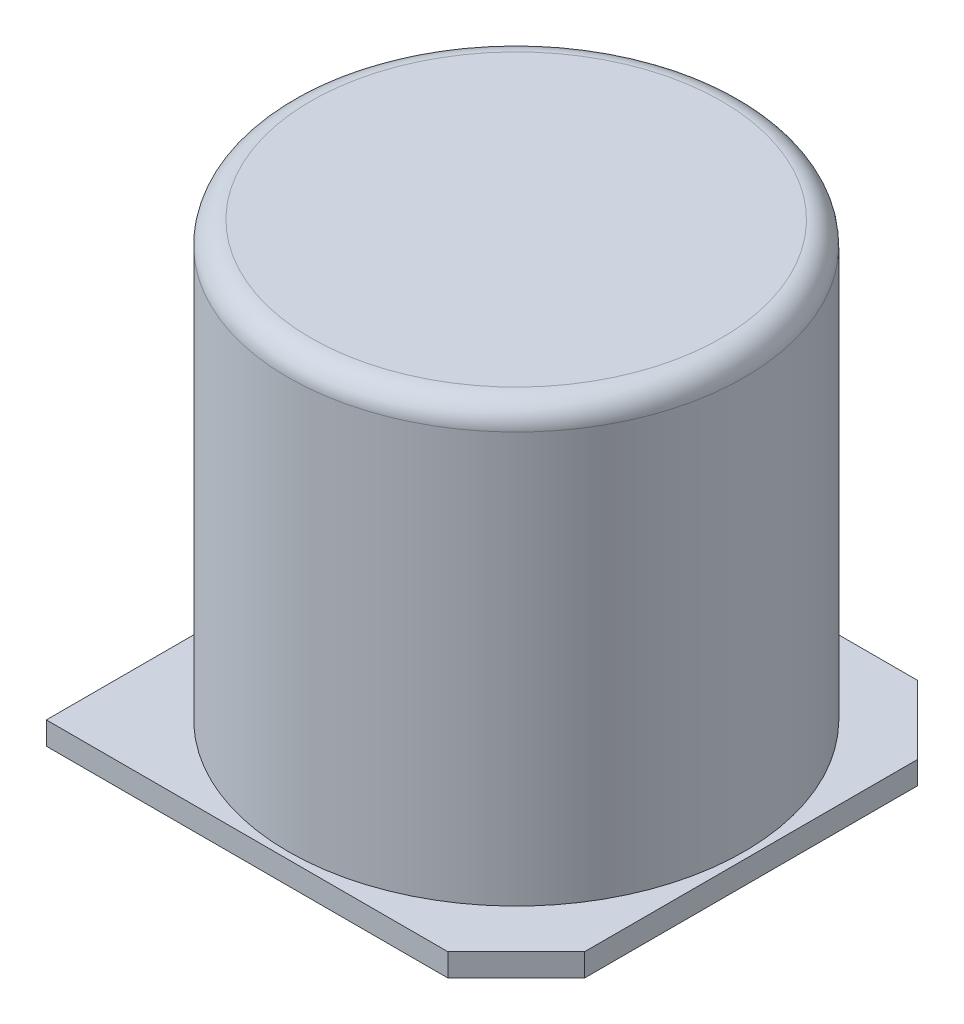
from build123d import *

# Parameters (mm, degrees)
SKETCH1_W           = 10.3
SKETCH1_H           = 10.3
BOSS_EXTRUDE1_DEPTH = 0.5
SKETCH2_R           = 5
BOSS_EXTRUDE2_DEPTH = 9.5
CHAMFER1_SIZE       = 1.5
FILLET1_R           = 0.5


with BuildPart() as part:
    # Sketch1 → Boss-Extrude1 (new body)
    with BuildSketch(Plane(origin=(0, 0, 0), x_dir=(1, 0, 0), z_dir=(0, 1, 0))):
        Rectangle(SKETCH1_W, SKETCH1_H)
    extrude(amount=BOSS_EXTRUDE1_DEPTH)

    # Sketch2 → Boss-Extrude2 (add)
    with BuildSketch(Plane(origin=(0, 0.5, 0), x_dir=(1, 0, 0), z_dir=(0, 1, 0))):
        with Locations(Location((0, 0, 0), (0, 0, 270))):
            Circle(SKETCH2_R)
    extrude(amount=BOSS_EXTRUDE2_DEPTH)

    # Chamfer1
    chamfer1_edges = [part.edges().sort_by_distance(p)[0] for p in [
        (5.15, 0.25, 5.15),
        (5.15, 0.25, -5.15),
    ]]
    chamfer(chamfer1_edges, length=CHAMFER1_SIZE)

    # Fillet1
    fillet1_edges = [part.edges().sort_by_distance(p)[0] for p in [
        (0, 10, -5),
    ]]
    fillet(fillet1_edges, radius=FILLET1_R)


solid = part.part
